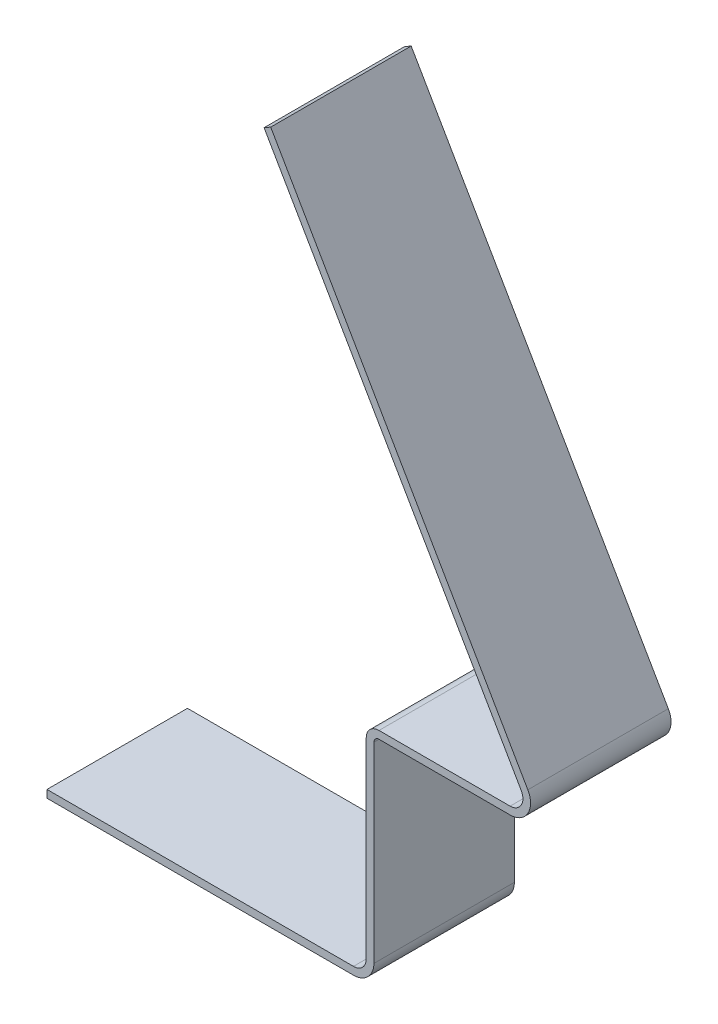
from build123d import *

# Parameters (mm, degrees)
EXTRU_MINCE1_DEPTH = 11


with BuildPart() as part:
    # Esquisse1 → Extru.-Mince1 (new body)
    with BuildSketch(Plane.XY):
        with BuildLine():
            Line((0, 0), (24, 0))
            ThreePointArc((24, 0), (24.707106781, 0.292893219), (25, 1))
            Line((25, 1), (25, 16))
            ThreePointArc((25, 16), (25.292893219, 16.707106781), (26, 17))
            Line((26, 17), (36.267949192, 17))
            ThreePointArc((36.267949192, 17), (37.133974596, 17.5), (37.133974596, 18.5))
            Line((37.133974596, 18.5), (17, 53.373066959))
            Line((17, 53.373066959), (17.519615242, 53.673066959))
            Line((17.519615242, 53.673066959), (37.653589838, 18.8))
            ThreePointArc((37.653589838, 18.8), (37.653589838, 17.2), (36.267949192, 16.4))
            Line((36.267949192, 16.4), (26, 16.4))
            ThreePointArc((26, 16.4), (25.717157288, 16.282842712), (25.6, 16))
            Line((25.6, 16), (25.6, 1))
            ThreePointArc((25.6, 1), (25.13137085, -0.13137085), (24, -0.6))
            Line((24, -0.6), (0, -0.6))
            Line((0, -0.6), (0, 0))
        make_face()
    extrude(amount=EXTRU_MINCE1_DEPTH)


solid = part.part
